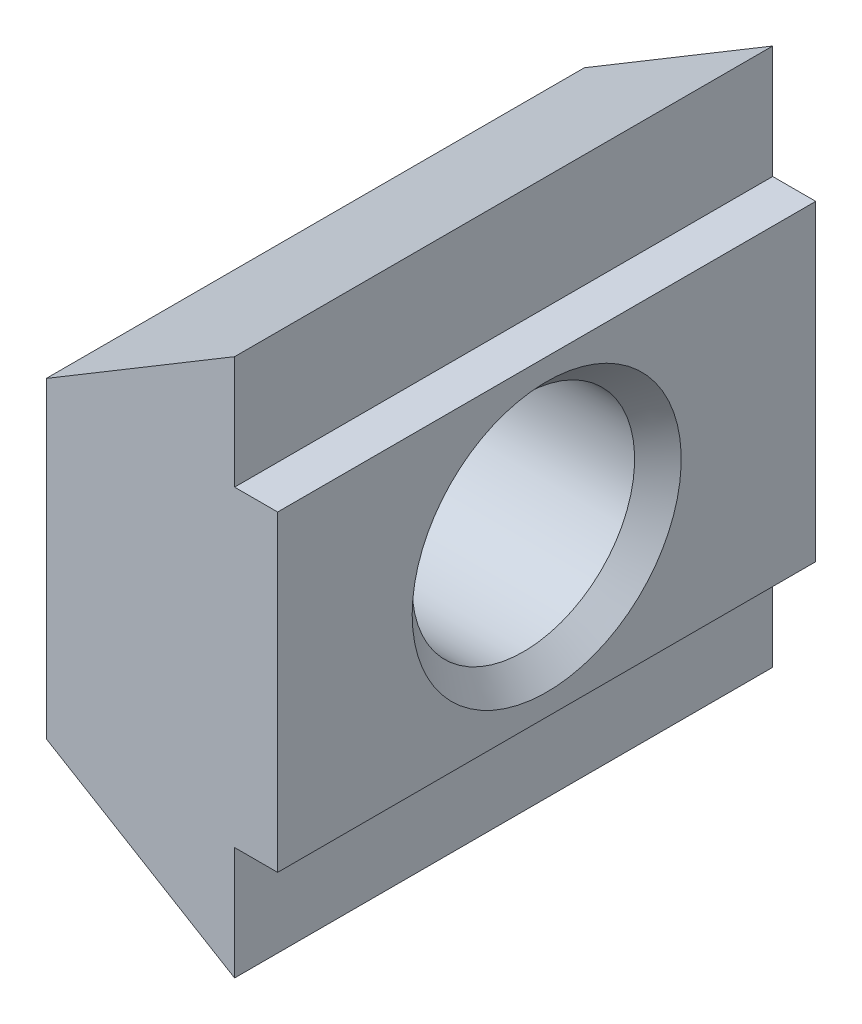
from build123d import *

# Parameters (mm, degrees)
BOSS_EXTRUDE1_DEPTH      = 5
BOSS_EXTRUDE1_DEPTH_BACK = 5


with BuildPart() as part:
    # Sketch1 → Boss-Extrude1 (new, two sides: drawn at the far end of the back side and taken through both)
    with BuildSketch(Plane.XY.offset(-BOSS_EXTRUDE1_DEPTH_BACK)):
        Polygon((-4.3, 2.9), (-4.3, -2.9), (-0.8, -5), (-0.8, -2.9), (0, -2.9), (0, 2.9), (-0.8, 2.9), (-0.8, 5), align=None)
    extrude(amount=BOSS_EXTRUDE1_DEPTH + BOSS_EXTRUDE1_DEPTH_BACK)

    # Sketch2 → Cut-Revolve1 (revolve, cut)
    with BuildSketch(Plane.XY):
        Polygon((-4.3, 0), (-4.3, 2.5), (-3.867, 2.067), (-0.433, 2.067), (0, 2.5), (0, 0), align=None)
    revolve(axis=Axis((0, 0, 0), (-1, 0, 0)), mode=Mode.SUBTRACT)


solid = part.part
